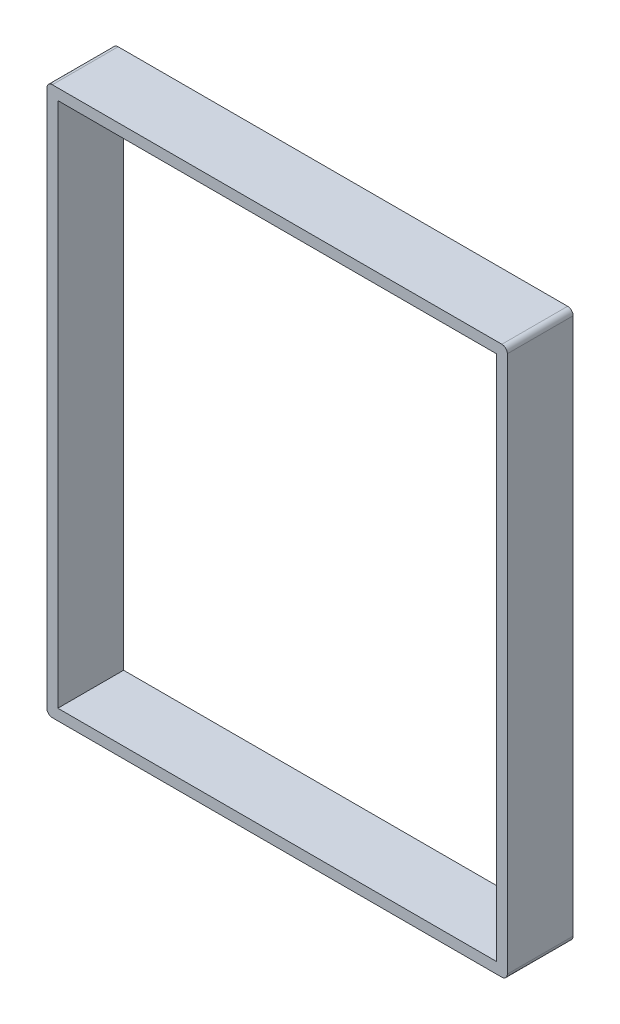
from build123d import *

# Parameters (mm, degrees)
SKETCH1_W           = 533.4
SKETCH1_H           = 635
BOSS_EXTRUDE1_DEPTH = 76.2
SKETCH2_W           = 508
SKETCH2_H           = 609.6
CUT_EXTRUDE1_DEPTH  = 422.594093887
FILLET1_R           = 6.35


with BuildPart() as part:
    # Sketch1 → Boss-Extrude1 (new body)
    with BuildSketch(Plane.XY):
        Rectangle(SKETCH1_W, SKETCH1_H)
    extrude(amount=BOSS_EXTRUDE1_DEPTH)

    # Sketch2 → Cut-Extrude1 (cut, through all)
    with BuildSketch(Plane.XY.offset(76.2)):
        Rectangle(SKETCH2_W, SKETCH2_H)
    extrude(amount=-CUT_EXTRUDE1_DEPTH, mode=Mode.SUBTRACT)

    # Fillet1
    fillet1_edges = [part.edges().sort_by_distance(p)[0] for p in [
        (266.7, -317.5, 38.1),
        (-266.7, -317.5, 38.1),
        (-266.7, 317.5, 38.1),
        (266.7, 317.5, 38.1),
    ]]
    fillet(fillet1_edges, radius=FILLET1_R)


solid = part.part
